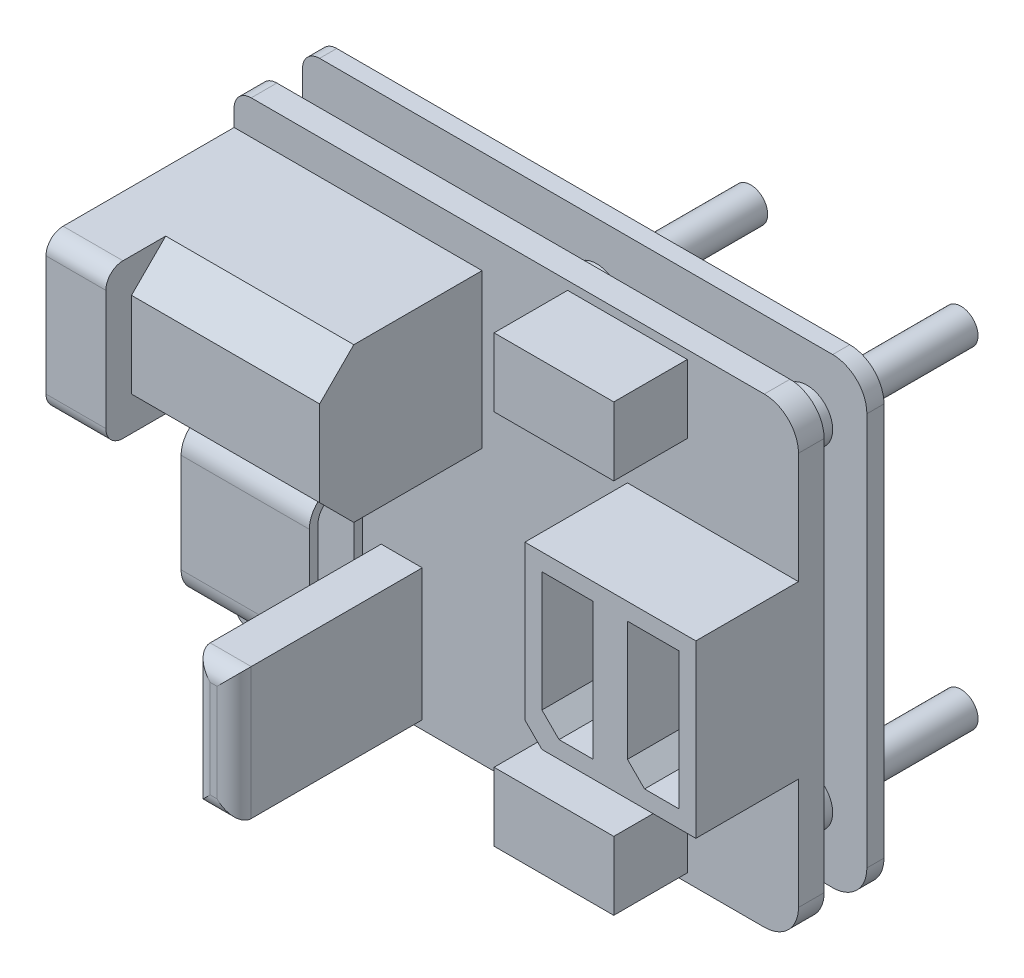
from build123d import *

# Parameters (mm, degrees)
SKETCH_1_W          = 33
SKETCH_1_H          = 27
EXTRUDE_1_DEPTH     = 5
FILLET_1_R          = 2
SKETCH_2_R          = 1
EXTRUDE_2_DEPTH     = 8
SKETCH_3_W          = 10
SKETCH_3_H          = 10
EXTRUDE_3_DEPTH     = 6
CHAMFER_1_SIZE      = 1
CUT_EXTRUDE_1_DEPTH = 4
SKETCH_5_W          = 14.5
SKETCH_5_H          = 9
SKETCH_5_W_2        = 2.4
SKETCH_5_H_2        = 7.7
EXTRUDE_4_DEPTH     = 11
SKETCH_6_R          = 2.85
SKETCH_6_R_2        = 0.5
CUT_EXTRUDE_2_DEPTH = 8
CUT_EXTRUDE_2_DRAFT = -3
CUT_EXTRUDE_3_DEPTH = 11
EXTRUDE_5_DEPTH     = 7.5
SKETCH_9_W          = 7
SKETCH_9_H          = 4
EXTRUDE_6_DEPTH     = 4.3
FILLET_2_R          = 1
CUT_EXTRUDE_START   = -3.5
SKETCH_10_R         = 1.5
CUT_EXTRUDE_4_DEPTH = 2.5


with BuildPart() as part:
    # 草图1 → 凸台-拉伸1 (new body)
    with BuildSketch(Plane.XY):
        with Locations((16.5, 13.5)):
            Rectangle(SKETCH_1_W, SKETCH_1_H)
    extrude(amount=EXTRUDE_1_DEPTH)

    # 圆角1
    fillet_1_edges = [part.edges().sort_by_distance(p)[0] for p in [
        (33, 27, 2.5),
        (33, 0, 2.5),
    ]]
    fillet(fillet_1_edges, radius=FILLET_1_R)

    # 草图2 → 凸台-拉伸2 (add)
    with BuildSketch(Plane(origin=(0, 0, 0), x_dir=(-1, 0, 0), z_dir=(0, 0, -1))):
        with Locations((-17.2, 23.2)):
            Circle(SKETCH_2_R)
        with Locations((-29.5, 23.2)):
            Circle(SKETCH_2_R)
        with Locations((-29.5, 3.8)):
            Circle(SKETCH_2_R)
        with Locations((-17.2, 3.8)):
            Circle(SKETCH_2_R)
    extrude(amount=EXTRUDE_2_DEPTH)

    # 草图3 → 凸台-拉伸3 (add)
    with BuildSketch(Plane.XY.offset(5)):
        with Locations((28, 13.5)):
            Rectangle(SKETCH_3_W, SKETCH_3_H)
    extrude(amount=EXTRUDE_3_DEPTH)

    # 倒角1
    chamfer_1_edges = [part.edges().sort_by_distance(p)[0] for p in [
        (23, 8.5, 8),
    ]]
    chamfer(chamfer_1_edges, length=CHAMFER_1_SIZE)

    # 草图4 → 切除-拉伸1 (cut)
    with BuildSketch(Plane.XY.offset(11)):
        Polygon((24, 17.5), (27, 17.5), (27, 9.5), (25, 9.5), (24, 10.5), align=None)
        Polygon((29, 17.5), (32, 17.5), (32, 9.5), (30, 9.5), (29, 10.5), align=None)
    extrude(amount=-CUT_EXTRUDE_1_DEPTH, mode=Mode.SUBTRACT)

    # 草图5 → 凸台-拉伸4 (add)
    with BuildSketch(Plane.XY.offset(5)):
        with Locations((7.25, 20.5)):
            Rectangle(SKETCH_5_W, SKETCH_5_H)
        with Locations((9.8, 4.35)):
            Rectangle(SKETCH_5_W_2, SKETCH_5_H_2)
    extrude(amount=EXTRUDE_4_DEPTH)


with BuildPart() as cut_extrude_2_tool:
    # 草图6 → 切除-拉伸2 (with draft: the straight prism first)
    with BuildSketch(Plane.ZY):
        with Locations((11.55, 20.5)):
            Circle(SKETCH_6_R)
        with Locations((11.55, 20.5)):
            Circle(SKETCH_6_R_2, mode=Mode.SUBTRACT)
    extrude(amount=-CUT_EXTRUDE_2_DEPTH)
    # 切除-拉伸2: the draft: its side faces are tilted about the plane it starts from
    cut_extrude_2_sides = [cut_extrude_2_tool.faces().sort_by_distance(p)[0] for p in [
        (4, 20.5, 8.7),
        (4, 20.5, 11.05),
    ]]
    draft(cut_extrude_2_sides, Plane.ZY, CUT_EXTRUDE_2_DRAFT)


with BuildPart() as part_1:
    add(part.part)

    # 切除-拉伸2: cut by cut_extrude_2_tool
    add(cut_extrude_2_tool.part, mode=Mode.SUBTRACT)

    # 草图7 → 切除-拉伸3 (cut)
    with BuildSketch(Plane(origin=(14.5, 0, 0), x_dir=(0, 0, -1), z_dir=(1, 0, 0))):
        Polygon((-14.5, 18), (-14.5, 23), (-12.5, 25), (-16, 25), (-16, 16), (-12.5, 16), align=None)
    extrude(amount=-CUT_EXTRUDE_3_DEPTH, mode=Mode.SUBTRACT)

    # 草图8 → 凸台-拉伸5 (add)
    with BuildSketch(Plane.ZY):
        with BuildLine():
            Line((8.1, 9.95), (8.1, 4.15))
            ThreePointArc((8.1, 4.15), (6.55, 2.6), (5, 4.15))
            Line((5, 4.15), (5, 9.95))
            ThreePointArc((5, 9.95), (6.55, 11.5), (8.1, 9.95))
        make_face()
        with BuildLine():
            Line((7.6, 9.95), (7.6, 4.15))
            ThreePointArc((7.6, 4.15), (6.55, 3.1), (5.5, 4.15))
            Line((5.5, 4.15), (5.5, 9.95))
            ThreePointArc((5.5, 9.95), (6.55, 11), (7.6, 9.95))
        make_face(mode=Mode.SUBTRACT)
    extrude(amount=-EXTRUDE_5_DEPTH)

    # 草图9 → 凸台-拉伸6 (add)
    with BuildSketch(Plane.XY.offset(5)):
        with Locations((23, 24.5)):
            Rectangle(SKETCH_9_W, SKETCH_9_H)
        with Locations((23, 2.5)):
            Rectangle(SKETCH_9_W, SKETCH_9_H)
    extrude(amount=EXTRUDE_6_DEPTH)

    # 圆角2
    fillet_2_edges = [part_1.edges().sort_by_distance(p)[0] for p in [
        (1.75, 16, 16),
        (8.6, 4.35, 16),
        (9.8, 0.5, 16),
        (11, 4.35, 16),
        (9.8, 8.2, 16),
        (1.75, 25, 16),
        (0, 27, 2.5),
        (0, 0, 2.5),
    ]]
    fillet(fillet_2_edges, radius=FILLET_2_R)

    # 草图10 → 切除-拉伸4 (cut)
    with BuildSketch(Plane(origin=(0, 0, 0), x_dir=(-1, 0, 0), z_dir=(0, 0, -1)).offset(CUT_EXTRUDE_START)):
        with BuildLine():
            ThreePointArc((-33, 2), (-32.414213562, 0.585786438), (-31, 0))
            Line((-31, 0), (-1, 0))
            ThreePointArc((-1, 0), (-0.292893219, 0.292893219), (0, 1))
            Line((0, 1), (0, 26))
            ThreePointArc((0, 26), (-0.292893219, 26.707106781), (-1, 27))
            Line((-1, 27), (-31, 27))
            ThreePointArc((-31, 27), (-32.414213562, 26.414213562), (-33, 25))
            Line((-33, 25), (-33, 2))
        make_face()
        with Locations((-17.2, 3.8)):
            Circle(SKETCH_10_R, mode=Mode.SUBTRACT)
        with Locations((-29.5, 3.8)):
            Circle(SKETCH_10_R, mode=Mode.SUBTRACT)
        with Locations((-17.2, 23.2)):
            Circle(SKETCH_10_R, mode=Mode.SUBTRACT)
        with Locations((-29.5, 23.2)):
            Circle(SKETCH_10_R, mode=Mode.SUBTRACT)
    extrude(amount=CUT_EXTRUDE_4_DEPTH, mode=Mode.SUBTRACT)


solid = part_1.part
